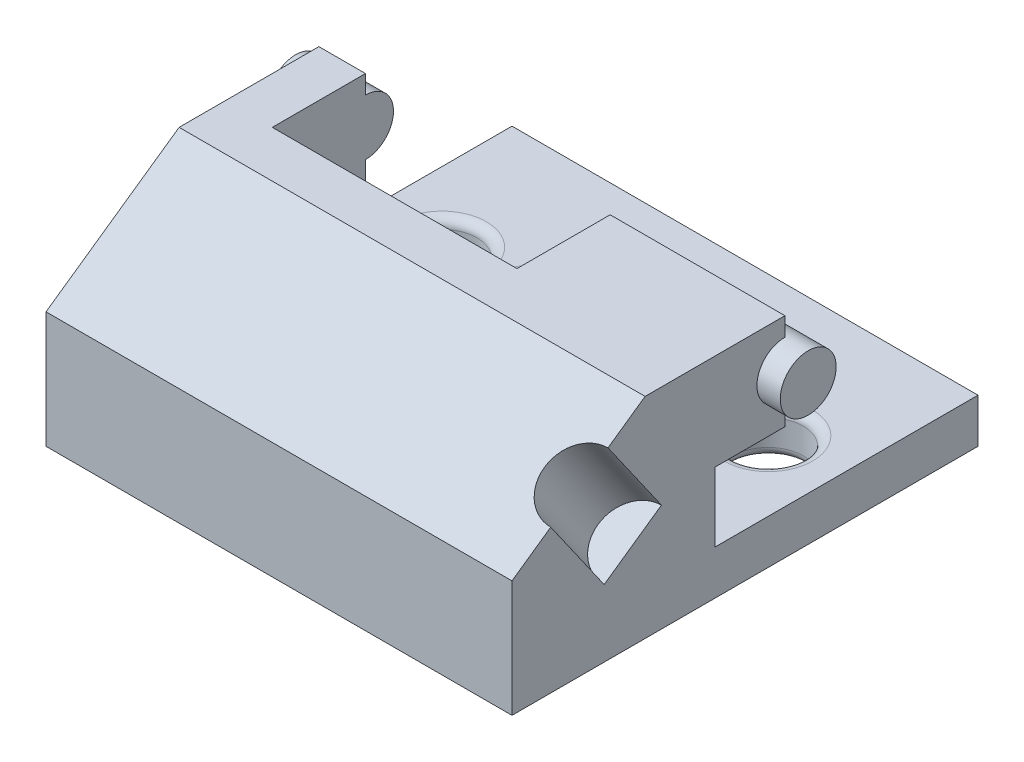
from build123d import *

# Parameters (mm, degrees)
SKETCH3_R           = 6
BOSS_EXTRUDE1_DEPTH = 100
BOSS_EXTRUDE2_START = 100
SKETCH3_3_R         = 6
BOSS_EXTRUDE2_DEPTH = 5
BOSS_EXTRUDE3_START = -5
SKETCH3_4_R         = 6
BOSS_EXTRUDE3_DEPTH = 5
CUT_EXTRUDE2_REACH  = 130.373
SKETCH4_W           = 52.5
SKETCH4_H           = 26
CUT_EXTRUDE3_DEPTH  = 20
SKETCH6_R           = 7.5
CUT_EXTRUDE4_DEPTH  = 126.357563949
FILLET1_R           = 2


with BuildPart() as part:
    # Sketch3 → Boss-Extrude1 (new body)
    with BuildSketch(Plane(origin=(0, 0, 0), x_dir=(0, 0, -1), z_dir=(1, 0, 0))):
        with BuildLine():
            Line((-58.562960135, -10), (-58.562960135, -35))
            Line((-58.562960135, -35), (41.437039865, -35))
            Line((41.437039865, -35), (41.437039865, -25.495049505))
            Line((41.437039865, -25.495049505), (-15, -25.495049505))
            Line((-15, -25.495049505), (-15, -10.643564356))
            Line((-15, -10.643564356), (0, -10.643564356))
            Line((0, -10.643564356), (0, -6))
            ThreePointArc((0, -6), (-6, 0), (0, 6))
            Line((0, 6), (0, 10))
            Line((0, 10), (-30, 10))
            Line((-30, 10), (-37.969507388, 4.419690851))
            Line((-37.969507388, 4.419690851), (-26.497978661, -11.963350035))
            Line((-26.497978661, -11.963350035), (-38.785259325, -20.56699658))
            Line((-38.785259325, -20.56699658), (-50.256788052, -4.183955694))
            Line((-50.256788052, -4.183955694), (-58.562960135, -10))
        make_face()
        Polygon((-37.969507388, 4.419690851), (-50.256788052, -4.183955694), (-38.785259325, -20.56699658), (-26.497978661, -11.963350035), align=None)
        Circle(SKETCH3_R)
    extrude(amount=BOSS_EXTRUDE1_DEPTH)

    # Sketch3<3> → Boss-Extrude2 (add)
    with BuildSketch(Plane(origin=(0, 0, 0), x_dir=(0, 0, -1), z_dir=(1, 0, 0)).offset(BOSS_EXTRUDE2_START)):
        with Locations(Location((0, 0, 0), (0, 0, 90))):
            Circle(SKETCH3_3_R)
    extrude(amount=BOSS_EXTRUDE2_DEPTH)

    # Sketch3<4> → Boss-Extrude3 (add)
    with BuildSketch(Plane(origin=(0, 0, 0), x_dir=(0, 0, -1), z_dir=(1, 0, 0)).offset(BOSS_EXTRUDE3_START)):
        Circle(SKETCH3_4_R)
    extrude(amount=BOSS_EXTRUDE3_DEPTH)

    # Cut-Extrude2: up to this face of the body (flat: up to its plane)
    cut_extrude2_end = Plane(part.part.faces().sort_by_distance((50, -25.495049505, -13.218519933))[0])
    # Sketch4 → Cut-Extrude2 (cut, up to the picked face)
    with BuildSketch(Plane(origin=(0, 10, 0), x_dir=(1, 0, 0), z_dir=(0, 1, 0)), mode=Mode.PRIVATE) as cut_extrude2_sk1:
        with Locations((36.25, -7)):
            Rectangle(SKETCH4_W, SKETCH4_H)
    cut_extrude2_tool1 = split(extrude(cut_extrude2_sk1.sketch, amount=-CUT_EXTRUDE2_REACH, mode=Mode.PRIVATE), bisect_by=cut_extrude2_end, keep=Keep.BOTH, mode=Mode.PRIVATE)
    add(cut_extrude2_tool1.solids().sort_by(Axis((36.25, 10, 7), (0, -1, 0)))[0], mode=Mode.SUBTRACT)

    # Sketch5 → Cut-Extrude3 (cut)
    with BuildSketch(Plane(origin=(0, 20.805490028, 14.568160954), x_dir=(1, 0, 0), z_dir=(0, 0.8191520442889929, 0.5735764363510445))):
        with BuildLine():
            Line((100, -28.56776907), (100, -43.56776907))
            ThreePointArc((100, -43.56776907), (92.5, -36.06776907), (100, -28.56776907))
        make_face()
    extrude(amount=-CUT_EXTRUDE3_DEPTH, mode=Mode.SUBTRACT)

    # Sketch6 → Cut-Extrude4 (cut, through all)
    with BuildSketch(Plane(origin=(0, -25.495049505, 0), x_dir=(1, 0, 0), z_dir=(0, 1, 0))):
        with Locations(Location((15, 11.437039865, 0), (0, 0, 270))):
            Circle(SKETCH6_R)
        with Locations(Location((85, 11.437039865, 0), (0, 0, 270))):
            Circle(SKETCH6_R)
        with BuildLine():
            Line((65, 3.937039865), (35, 3.937039865))
            ThreePointArc((35, 3.937039865), (27.5, 11.437039865), (35, 18.937039865))
            Line((35, 18.937039865), (65, 18.937039865))
            ThreePointArc((65, 18.937039865), (72.5, 11.437039865), (65, 3.937039865))
        make_face()
    extrude(amount=-CUT_EXTRUDE4_DEPTH, mode=Mode.SUBTRACT)

    # Fillet1
    fillet1_edges = [part.edges().sort_by_distance(p)[0] for p in [
        (72.5, -35, -11.437039865),
        (50, -35, -3.937039865),
        (27.5, -35, -11.437039865),
        (50, -35, -18.937039865),
        (72.5, -25.495049505, -11.437039865),
        (50, -25.495049505, -18.937039865),
        (27.5, -25.495049505, -11.437039865),
        (50, -25.495049505, -3.937039865),
        (15, -35, -18.937039865),
        (15, -25.495049505, -18.937039865),
        (85, -35, -18.937039865),
        (85, -25.495049505, -18.937039865),
    ]]
    fillet(fillet1_edges, radius=FILLET1_R)


solid = part.part
